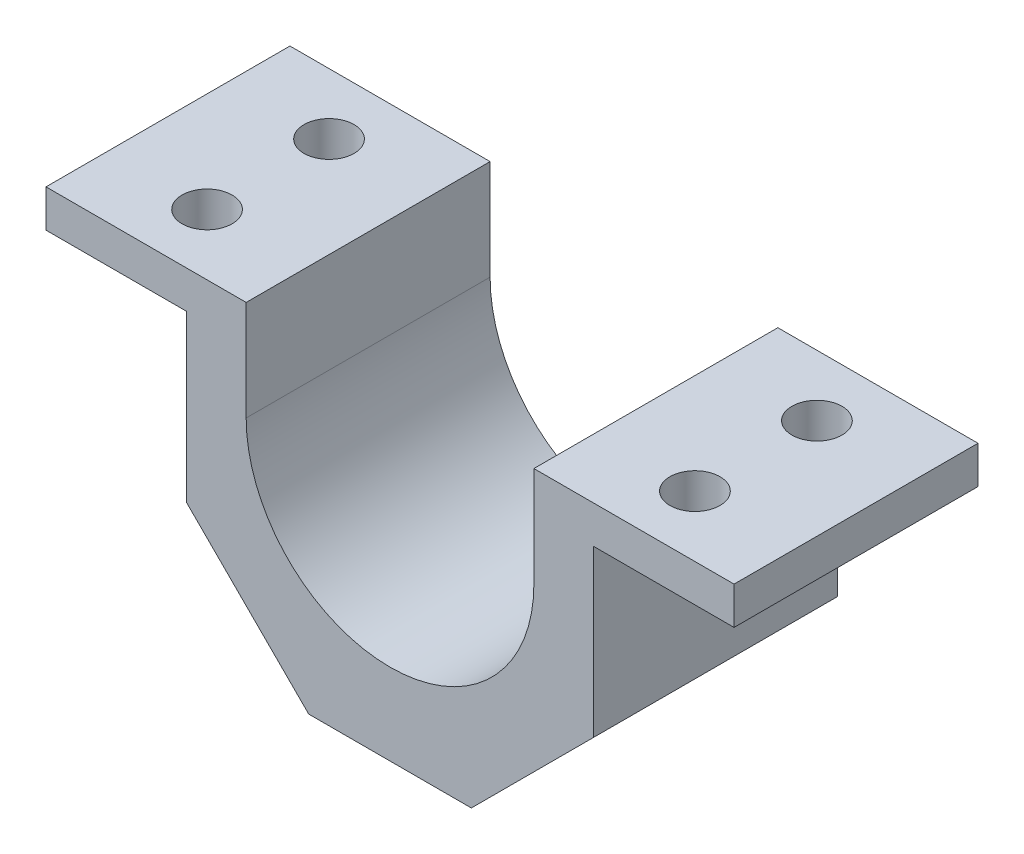
from build123d import *

# Parameters (mm, degrees)
BOSS_EXTRUDE1_DEPTH = 39
SKETCH2_R           = 4
CUT_EXTRUDE1_DEPTH  = 39


with BuildPart() as part:
    # Sketch1 → Boss-Extrude1 (new body)
    with BuildSketch(Plane.XY):
        with BuildLine():
            Line((-55, 16), (-55, 10))
            Line((-55, 10), (-32.5, 10))
            Line((-32.5, 10), (-32.5, -16.5))
            Line((-32.5, -16.5), (-13, -36))
            Line((-13, -36), (13, -36))
            Line((13, -36), (32.5, -16.5))
            Line((32.5, -16.5), (32.5, 10))
            Line((32.5, 10), (55, 10))
            Line((55, 10), (55, 16))
            Line((55, 16), (23, 16))
            Line((23, 16), (23, 0))
            ThreePointArc((23, 0), (0, -23), (-23, 0))
            Line((-23, 0), (-23, 16))
            Line((-23, 16), (-55, 16))
        make_face()
    extrude(amount=BOSS_EXTRUDE1_DEPTH)

    # Sketch2 → Cut-Extrude1 (cut)
    with BuildSketch(Plane(origin=(0, 16, 0), x_dir=(1, 0, 0), z_dir=(0, 1, 0))):
        with Locations(Location((-39, -9.75, 0), (0, 0, 270))):
            Circle(SKETCH2_R)
        with Locations(Location((-39, -29.25, 0), (0, 0, 270))):
            Circle(SKETCH2_R)
        with Locations(Location((39, -9.75, 0), (0, 0, 270))):
            Circle(SKETCH2_R)
        with Locations(Location((39, -29.25, 0), (0, 0, 270))):
            Circle(SKETCH2_R)
    extrude(amount=-CUT_EXTRUDE1_DEPTH, mode=Mode.SUBTRACT)


solid = part.part
